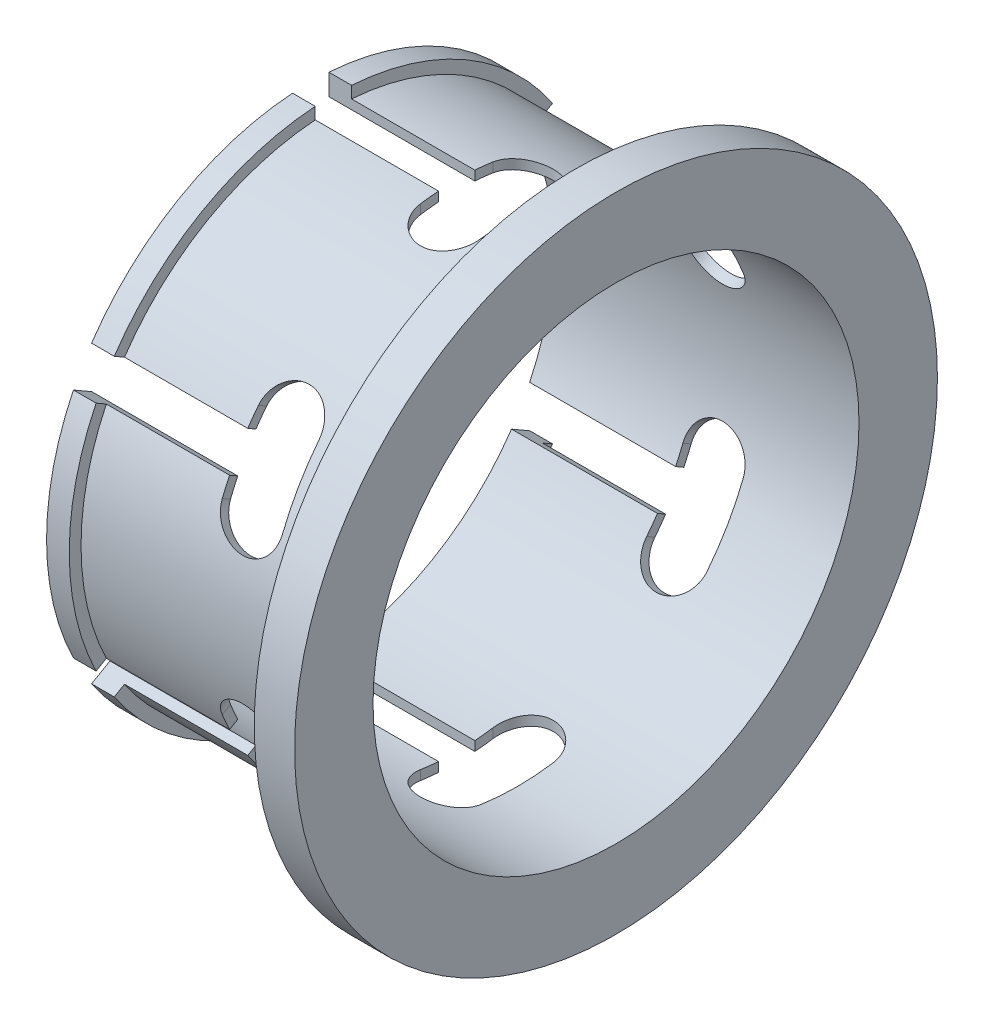
from build123d import *

# Parameters (mm, degrees)
CUT_EXTRUDE1_REACH      = 174.288
CUT_EXTRUDE1_END_RADIUS = 83.11399811
CIRPATTERN1_COUNT       = 6


with BuildPart() as part:
    # Sketch3 → Revolve1 (revolve)
    with BuildSketch(Plane.XY, mode=Mode.PRIVATE) as revolve1_sk:
        Polygon((0, 76.454), (-12.7, 76.454), (-96.056652475, 76.454), (-96.056652475, 83.11399811), (-88.916030092, 83.11399811), (-88.916030092, 79.409655253), (-12.7, 79.409655253), (-12.7, 101.133908192), (0, 101.133908192), align=None)
    revolve(revolve1_sk.sketch.rotate(Axis((0, 0, 0), (-1, 0, 0)), 90), axis=Axis((0, 0, 0), (-1, 0, 0)))

    # Cut-Extrude1: up to this cylinder (the profile starts inside it)
    cut_extrude1_end = Plane(origin=(-54.354786, 0, 0), z_dir=(1, 0, 0)) * Cylinder(CUT_EXTRUDE1_END_RADIUS, 515.80399622, mode=Mode.PRIVATE)
    # Sketch4 → Cut-Extrude1 (cut, up to the surface)
    with BuildSketch(Plane(origin=(0, 0, 0), x_dir=(1, 0, 0), z_dir=(0, 1, 0)), mode=Mode.PRIVATE) as cut_extrude1_sk1:
        with BuildLine():
            Line((-96.056652475, 5.715), (-96.056652475, -5.715))
            Line((-96.056652475, -5.715), (-50.130677034, -5.715))
            Line((-50.130677034, -5.715), (-50.130677034, -11.384258727))
            ThreePointArc((-50.130677034, -11.384258727), (-40.62678108, -20.888154681), (-31.122885127, -11.384258727))
            Line((-31.122885127, -11.384258727), (-31.122885127, 11.384258727))
            ThreePointArc((-31.122885127, 11.384258727), (-40.62678108, 20.888154681), (-50.130677034, 11.384258727))
            Line((-50.130677034, 11.384258727), (-50.130677034, 5.715))
            Line((-50.130677034, 5.715), (-96.056652475, 5.715))
        make_face()
    cut_extrude1_tool1 = extrude(cut_extrude1_sk1.sketch, amount=-CUT_EXTRUDE1_REACH, mode=Mode.PRIVATE) & cut_extrude1_end
    cut_extrude1 = cut_extrude1_tool1.solids().sort_by_distance((-54.354786, 0, 0))[0]
    add(cut_extrude1, mode=Mode.SUBTRACT)

    # CirPattern1: Cut-Extrude1 ×6 about axis
    cirpattern1_axis = Axis((0, 0, 0), (1, 0, 0))
    for i in range(1, CIRPATTERN1_COUNT):
        add(cut_extrude1.rotate(cirpattern1_axis, i * 360 / CIRPATTERN1_COUNT), mode=Mode.SUBTRACT)


solid = part.part
